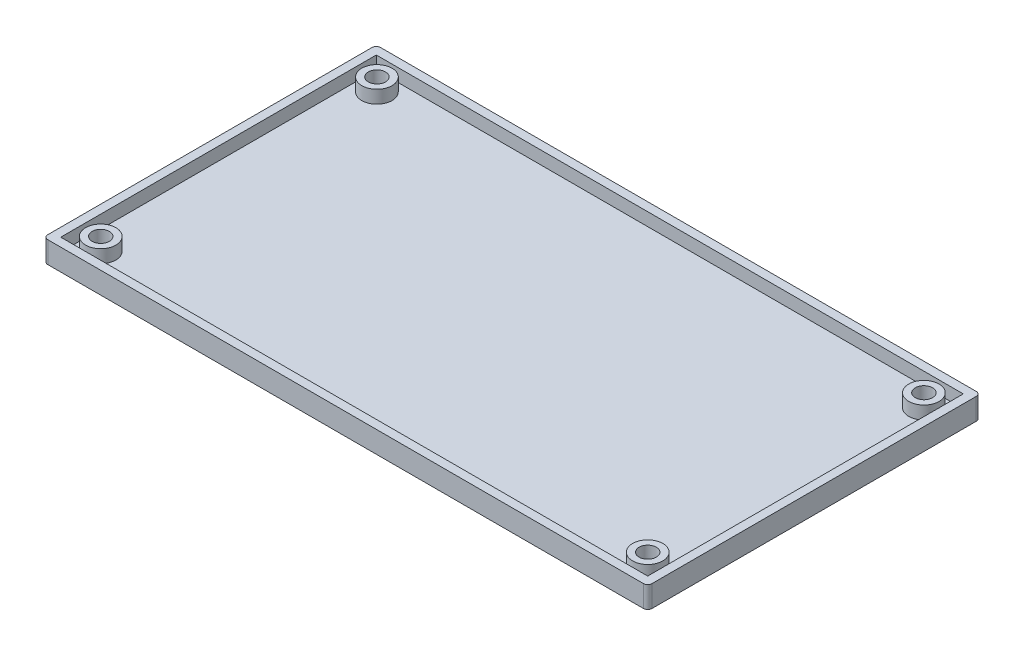
from build123d import *

# Parameters (mm, degrees)
SKETCH2_W           = 139.954254508
SKETCH2_H           = 77.088138176
BOSS_EXTRUDE1_DEPTH = 2
SKETCH3_W           = 139.954254508
SKETCH3_H           = 77.088138176
SKETCH3_W_2         = 135.954254508
SKETCH3_H_2         = 73.088138176
SKETCH3_R           = 3.5
BOSS_EXTRUDE2_DEPTH = 3
SKETCH4_R           = 2
CUT_EXTRUDE1_DEPTH  = 9
FILLET1_R           = 1


with BuildPart() as part:
    # Sketch2 → Boss-Extrude1 (new body)
    with BuildSketch(Plane(origin=(0, 0, 0), x_dir=(1, 0, 0), z_dir=(0, 1, 0))):
        with Locations((67.02005334, 35.392456185)):
            Rectangle(SKETCH2_W, SKETCH2_H)
    extrude(amount=BOSS_EXTRUDE1_DEPTH)

    # Sketch3 → Boss-Extrude2 (add)
    # profile 1 of 5: a face of its own
    with BuildSketch(Plane(origin=(0, 2, 0), x_dir=(1, 0, 0), z_dir=(0, 1, 0))):
        with Locations((67.02005334, 35.392456185)):
            Rectangle(SKETCH3_W, SKETCH3_H)
        with Locations((67.02005334, 35.392456185)):
            Rectangle(SKETCH3_W_2, SKETCH3_H_2, mode=Mode.SUBTRACT)
    # profile 2 of 5: a face of its own
    with BuildSketch(Plane(origin=(0, 2, 0), x_dir=(1, 0, 0), z_dir=(0, 1, 0))):
        with Locations(Location((3.516129032, 3.642875286, 0), (0, 0, 90))):
            Circle(SKETCH3_R)
    # profile 3 of 5: a face of its own
    with BuildSketch(Plane(origin=(0, 2, 0), x_dir=(1, 0, 0), z_dir=(0, 1, 0))):
        with Locations(Location((3.516129032, 67.60985522, 0), (0, 0, 90))):
            Circle(SKETCH3_R)
    # profile 4 of 5: a face of its own
    with BuildSketch(Plane(origin=(0, 2, 0), x_dir=(1, 0, 0), z_dir=(0, 1, 0))):
        with Locations(Location((130.202184404, 67.61010922, 0), (0, 0, 90))):
            Circle(SKETCH3_R)
    # profile 5 of 5: a face of its own
    with BuildSketch(Plane(origin=(0, 2, 0), x_dir=(1, 0, 0), z_dir=(0, 1, 0))):
        with Locations(Location((130.202184404, 3.642875286, 0), (0, 0, 90))):
            Circle(SKETCH3_R)
    extrude(amount=BOSS_EXTRUDE2_DEPTH)

    # Sketch4 → Cut-Extrude1 (cut)
    with BuildSketch(Plane(origin=(0, 5, 0), x_dir=(1, 0, 0), z_dir=(0, 1, 0))):
        with Locations(Location((3.516129032, 67.60985522, 0), (0, 0, 270))):
            Circle(SKETCH4_R)
        with Locations(Location((130.202184404, 67.61010922, 0), (0, 0, 270))):
            Circle(SKETCH4_R)
        with Locations(Location((130.202184404, 3.642875286, 0), (0, 0, 270))):
            Circle(SKETCH4_R)
        with Locations(Location((3.516129032, 3.642875286, 0), (0, 0, 270))):
            Circle(SKETCH4_R)
    extrude(amount=-CUT_EXTRUDE1_DEPTH, mode=Mode.SUBTRACT)

    # Fillet1
    fillet1_edges = [part.edges().sort_by_distance(p)[0] for p in [
        (136.997180594, 2.5, -73.936525273),
        (136.997180594, 2.5, 3.151612903),
        (-2.957073914, 2.5, 3.151612903),
        (-2.957073914, 2.5, -73.936525273),
    ]]
    fillet(fillet1_edges, radius=FILLET1_R)


solid = part.part
